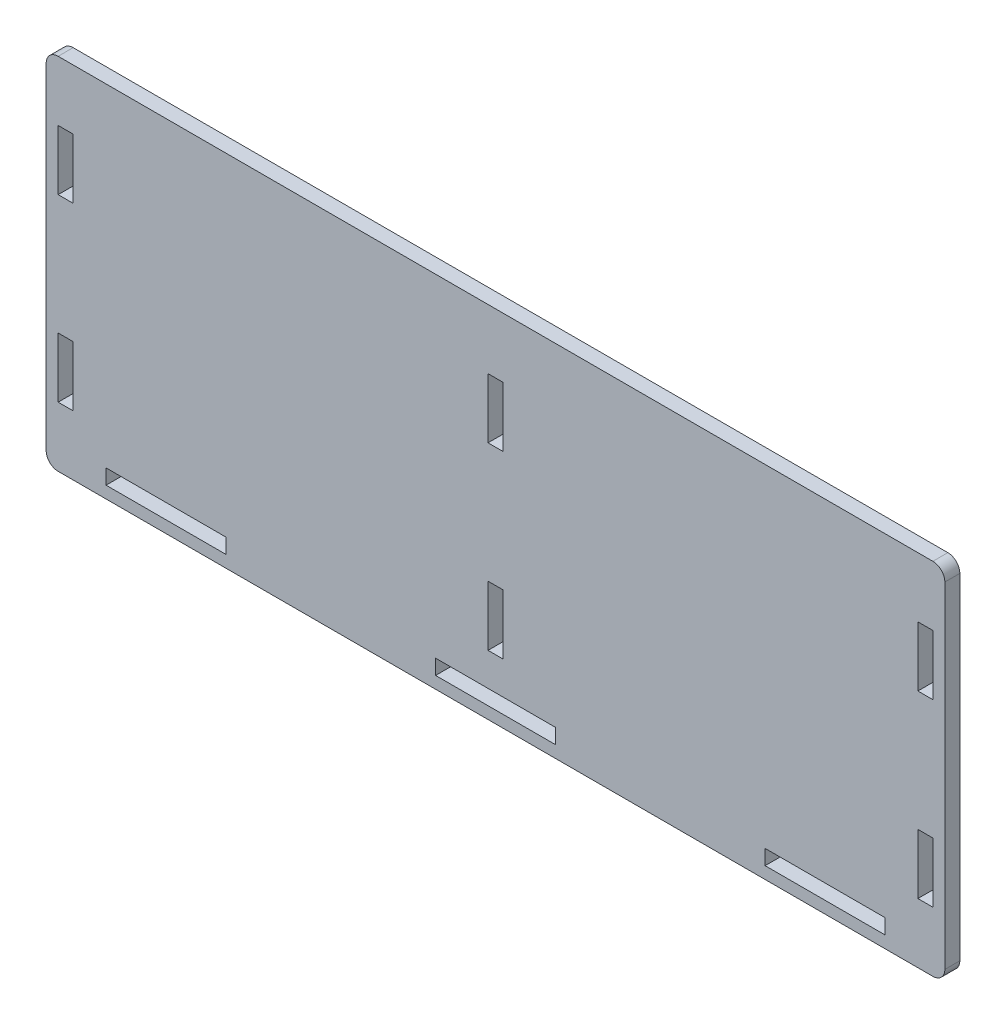
from build123d import *

# Parameters (mm, degrees)
SKETCH1_W           = 150
SKETCH1_H           = 60
SKETCH1_W_2         = 2.5
SKETCH1_H_2         = 10
SKETCH1_W_3         = 20
SKETCH1_H_3         = 2.5
BOSS_EXTRUDE1_DEPTH = 2.5
FILLET2_R           = 2


with BuildPart() as part:
    # Sketch1 → Boss-Extrude1 (new body)
    with BuildSketch(Plane.XY):
        Rectangle(SKETCH1_W, SKETCH1_H)
        with Locations((-71.75, -15)):
            Rectangle(SKETCH1_W_2, SKETCH1_H_2, mode=Mode.SUBTRACT)
        with Locations((-71.75, 15)):
            Rectangle(SKETCH1_W_2, SKETCH1_H_2, mode=Mode.SUBTRACT)
        with Locations((0, 15)):
            Rectangle(SKETCH1_W_2, SKETCH1_H_2, mode=Mode.SUBTRACT)
        with Locations((0, -15)):
            Rectangle(SKETCH1_W_2, SKETCH1_H_2, mode=Mode.SUBTRACT)
        with Locations((71.75, 15)):
            Rectangle(SKETCH1_W_2, SKETCH1_H_2, mode=Mode.SUBTRACT)
        with Locations((71.75, -15)):
            Rectangle(SKETCH1_W_2, SKETCH1_H_2, mode=Mode.SUBTRACT)
        with Locations((0, -26.75)):
            Rectangle(SKETCH1_W_3, SKETCH1_H_3, mode=Mode.SUBTRACT)
        with Locations((-55, -26.75)):
            Rectangle(SKETCH1_W_3, SKETCH1_H_3, mode=Mode.SUBTRACT)
        with Locations((55, -26.75)):
            Rectangle(SKETCH1_W_3, SKETCH1_H_3, mode=Mode.SUBTRACT)
    extrude(amount=BOSS_EXTRUDE1_DEPTH)

    # Fillet2
    fillet2_edges = [part.edges().sort_by_distance(p)[0] for p in [
        (75, -30, 1.25),
        (-75, -30, 1.25),
        (-75, 30, 1.25),
        (75, 30, 1.25),
    ]]
    fillet(fillet2_edges, radius=FILLET2_R)


solid = part.part
